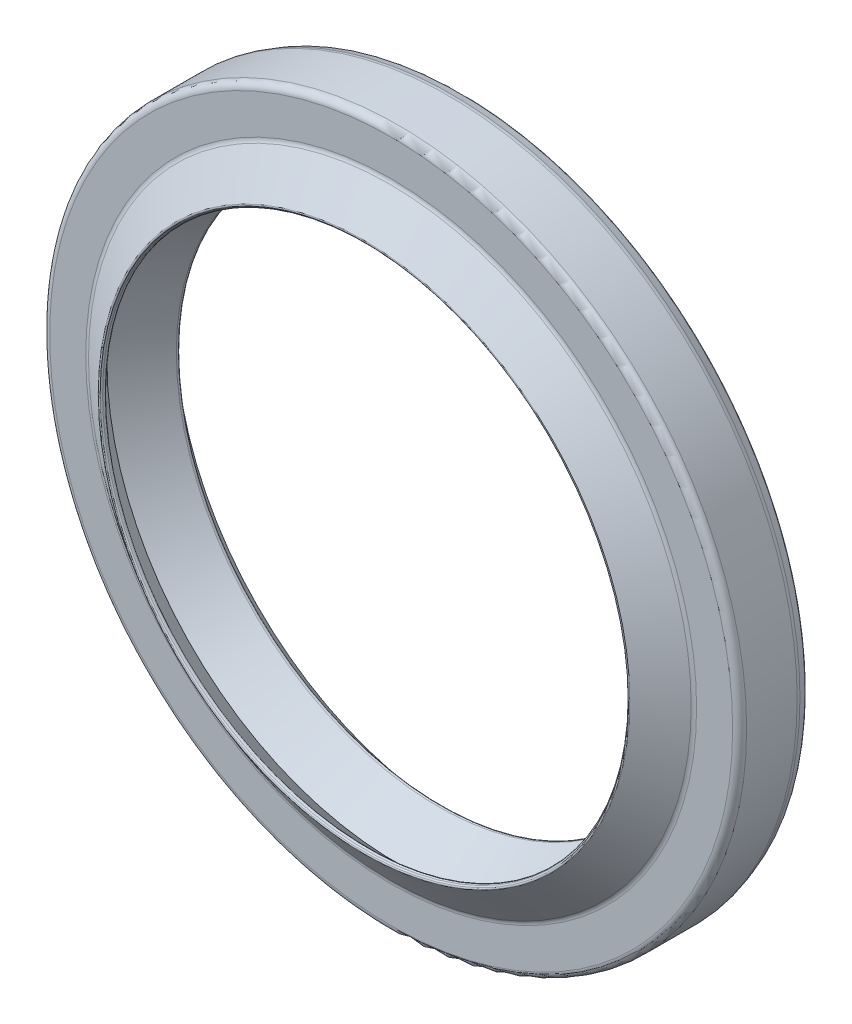
from build123d import *

# Parameters (mm, degrees)
FILLET_1_R = 1
FILLET_2_R = 0.2
FILLET_3_R = 1
FILLET_4_R = 0.3
FILLET_5_R = 1.5
FILLET_6_R = 0.3
FILLET_7_R = 0.5
FILLET_8_R = 0.3
SKETCH_5_R = 0.75


with BuildPart() as part:
    # Эскиз1 → Повернуть1 (revolve)
    with BuildSketch(Plane(origin=(0, 0, 0), x_dir=(0, 0, -1), z_dir=(1, 0, 0)), mode=Mode.PRIVATE) as revolve_1_sk:
        with BuildLine():
            Line((-13.706625508, 37.706625508), (-14, 38))
            Line((-14, 38), (-10, 43.5))
            Line((-10, 43.5), (-10, 50))
            Line((-10, 50), (-1.5, 50))
            Line((-1.5, 50), (0, 49.5))
            Line((0, 49.5), (0, 46.5))
            Line((0, 46.5), (-7, 46.5))
            Line((-7, 46.5), (-7, 42.5))
            Line((-7, 42.5), (-1.75, 42.5))
            ThreePointArc((-1.75, 42.5), (-1, 41.75), (-0.25, 42.5))
            Line((-0.25, 42.5), (-0.25, 40.703470277))
            Line((-0.25, 40.703470277), (-2.809513055, 37.683098187))
            ThreePointArc((-2.809513055, 37.683098187), (-2.993467268, 37.580431153), (-3.199571431, 37.624028701))
            Line((-3.199571431, 37.624028701), (-9.283884091, 41.5))
            Line((-9.283884091, 41.5), (-13.288012759, 37.701120886))
            ThreePointArc((-13.288012759, 37.701120886), (-13.498438036, 37.618783476), (-13.706625508, 37.706625508))
        make_face()
    revolve(revolve_1_sk.sketch.rotate(Axis((0, 0, 0), (0, 0, 1)), 90), axis=Axis((0, 0, 0), (0, 0, 1)))

    # Скругление1
    fillet_1_edges = [part.edges().sort_by_distance(p)[0] for p in [
        (43.5, 0, 10),
    ]]
    fillet(fillet_1_edges, radius=FILLET_1_R)

    # Скругление2
    fillet_2_edges = [part.edges().sort_by_distance(p)[0] for p in [
        (38, 0, 14),
    ]]
    fillet(fillet_2_edges, radius=FILLET_2_R)

    # Скругление3
    fillet_3_edges = [part.edges().sort_by_distance(p)[0] for p in [
        (50, 0, 10),
    ]]
    fillet(fillet_3_edges, radius=FILLET_3_R)

    # Скругление4
    fillet_4_edges = [part.edges().sort_by_distance(p)[0] for p in [
        (49.5, 0, 0),
    ]]
    fillet(fillet_4_edges, radius=FILLET_4_R)

    # Скругление5
    fillet_5_edges = [part.edges().sort_by_distance(p)[0] for p in [
        (50, 0, 1.5),
    ]]
    fillet(fillet_5_edges, radius=FILLET_5_R)

    # Скругление6
    fillet_6_edges = [part.edges().sort_by_distance(p)[0] for p in [
        (46.5, 0, 0),
    ]]
    fillet(fillet_6_edges, radius=FILLET_6_R)

    # Скругление7
    fillet_7_edges = [part.edges().sort_by_distance(p)[0] for p in [
        (46.5, 0, 7),
    ]]
    fillet(fillet_7_edges, radius=FILLET_7_R)

    # Скругление8
    fillet_8_edges = [part.edges().sort_by_distance(p)[0] for p in [
        (42.5, 0, 7),
    ]]
    fillet(fillet_8_edges, radius=FILLET_8_R)


with BuildPart() as body_2:
    # Эскиз5 → Повернуть2 (revolve)
    with BuildSketch(Plane(origin=(0, 0, 0), x_dir=(0, 0, -1), z_dir=(1, 0, 0)), mode=Mode.PRIVATE) as revolve_2_sk:
        with Locations((-1, 42.5)):
            Circle(SKETCH_5_R)
    revolve(revolve_2_sk.sketch.rotate(Axis((0, 0, 0), (0, 0, -1)), 90), axis=Axis((0, 0, 0), (0, 0, -1)))


solid = Compound([part.part, body_2.part])
